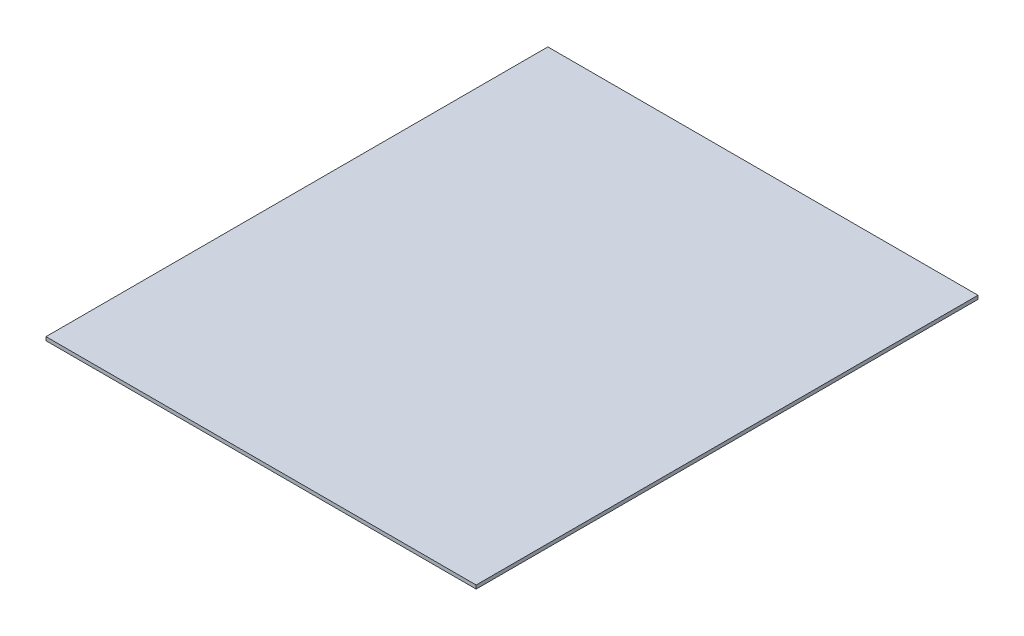
from build123d import *

# Parameters (mm, degrees)
SKETCH1_W           = 1200
SKETCH1_H           = 1400
BOSS_EXTRUDE1_DEPTH = 10


with BuildPart() as part:
    # Sketch1 → Boss-Extrude1 (new body)
    with BuildSketch(Plane(origin=(0, 0, 0), x_dir=(1, 0, 0), z_dir=(0, 1, 0))):
        Rectangle(SKETCH1_W, SKETCH1_H)
    extrude(amount=BOSS_EXTRUDE1_DEPTH)


solid = part.part
